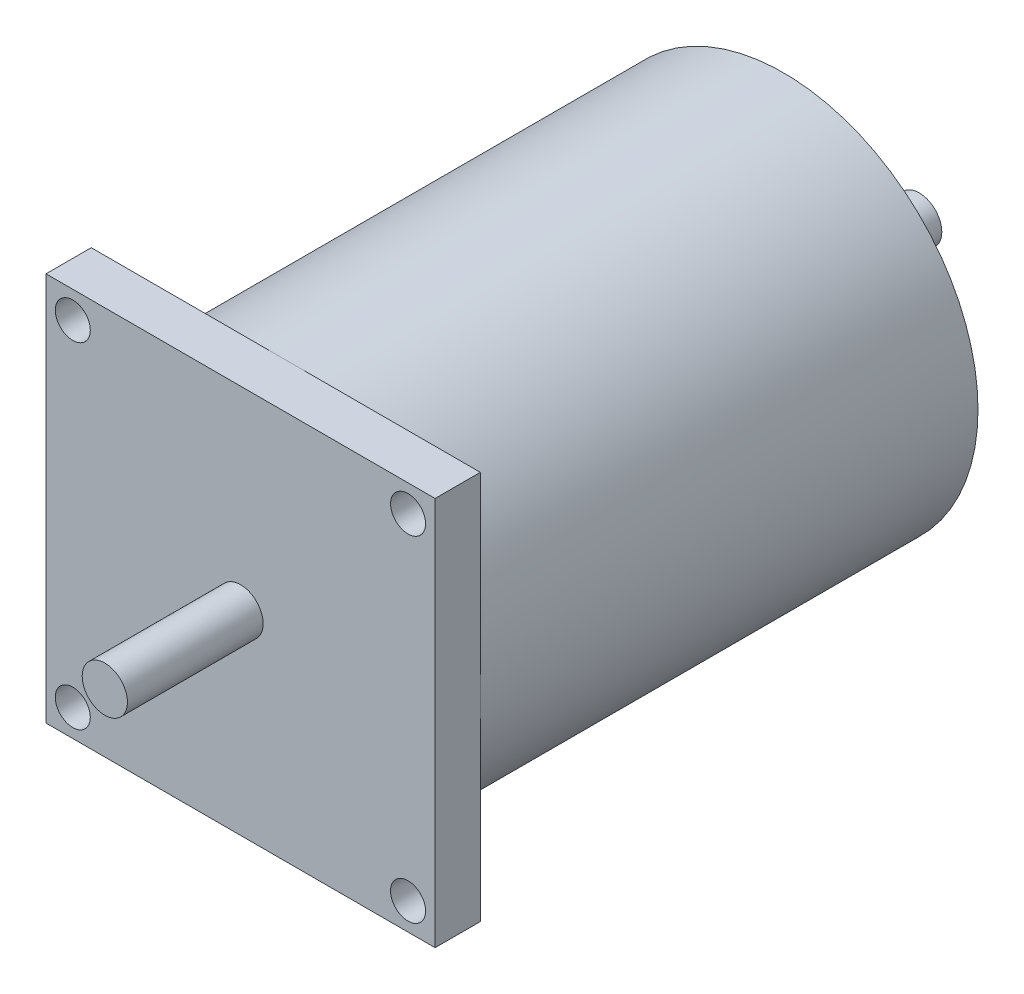
from build123d import *

# Parameters (mm, degrees)
SKETCH1_W                    = 54.61
SKETCH1_H                    = 54.61
BOSS_EXTRUDE1_DEPTH          = 6.35
F_10_0_1935_DIAMETER_HOLE1_D = 4.9149
SKETCH7_R                    = 27.305
BOSS_EXTRUDE2_DEPTH          = 69.85
SKETCH8_R                    = 3.175
BOSS_EXTRUDE3_DEPTH          = 19.05
BOSS_EXTRUDE4_START          = 19.05
SKETCH9_R                    = 3.175
BOSS_EXTRUDE4_DEPTH          = 19.05


with BuildPart() as part:
    # Sketch1 → Boss-Extrude1 (new body)
    with BuildSketch(Plane.XY):
        Rectangle(SKETCH1_W, SKETCH1_H)
    extrude(amount=BOSS_EXTRUDE1_DEPTH)

    # #10 (0.1935) Diameter Hole1 (through all)
    with Locations(Plane.XY.offset(6.35)):
        with Locations((-23.5458, 23.5458), (23.510742074, 23.5458), (23.510742074, -23.510742074), (-23.5458, -23.510742074)):
            Hole(F_10_0_1935_DIAMETER_HOLE1_D / 2)

    # Sketch7 → Boss-Extrude2 (add)
    with BuildSketch(Plane(origin=(0, 0, 0), x_dir=(-1, 0, 0), z_dir=(0, 0, -1))):
        Circle(SKETCH7_R)
    extrude(amount=BOSS_EXTRUDE2_DEPTH)

    # Sketch8 → Boss-Extrude3 (add)
    with BuildSketch(Plane(origin=(0, 0, -69.85), x_dir=(-1, 0, 0), z_dir=(0, 0, -1))):
        with Locations(Location((0, 0, 0), (0, 0, 180))):
            Circle(SKETCH8_R)
    extrude(amount=BOSS_EXTRUDE3_DEPTH)

    # Sketch9 → Boss-Extrude4 (add)
    with BuildSketch(Plane.XY.offset(6.35).offset(BOSS_EXTRUDE4_START)):
        Circle(SKETCH9_R)
    extrude(amount=-BOSS_EXTRUDE4_DEPTH)


solid = part.part
